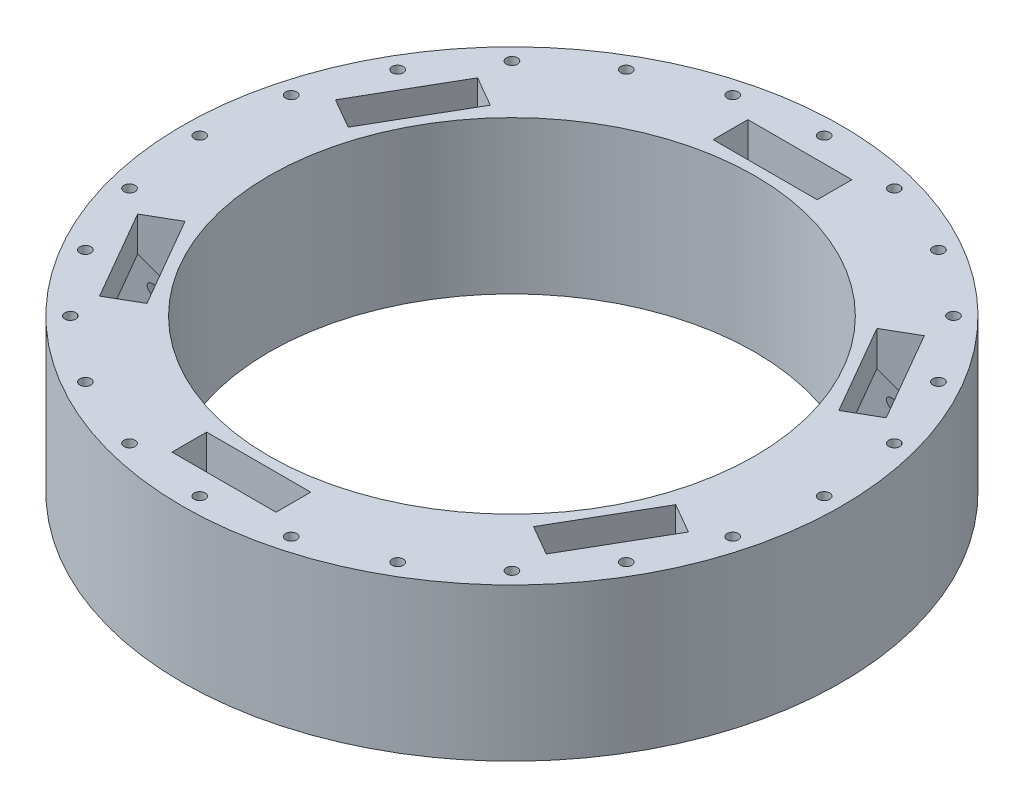
from build123d import *

# Parameters (mm, degrees)
SKETCH1_R            = 95
SKETCH1_R_2          = 70
BOSS_EXTRUDE1_DEPTH  = 44
CUT_EXTRUDE3_DEPTH   = 15
CIRPATTERN2_COUNT    = 6
M3_CLEARANCE_HOLE1_D = 3.2
M3_CLEARANCE_HOLE2_D = 3.2


with BuildPart() as part:
    # Sketch1 → Boss-Extrude1 (new body)
    with BuildSketch(Plane(origin=(0, 0, 0), x_dir=(1, 0, 0), z_dir=(0, 1, 0))):
        Circle(SKETCH1_R)
        Circle(SKETCH1_R_2, mode=Mode.SUBTRACT)
    extrude(amount=BOSS_EXTRUDE1_DEPTH)

    # Sketch7 → Cut-Extrude3 (cut, symmetric)
    with BuildSketch(Plane(origin=(0, 0, 0), x_dir=(0, -1, 0), z_dir=(-0.500000000000001, 0, 0.866025403784438))):
        Polygon((-44, 83), (-34, 83), (-29, 78), (-34, 73), (-44, 73), align=None)
        Polygon((-10, 83), (0, 83), (0, 73), (-10, 73), (-15, 78), align=None)
    cut_extrude3 = extrude(amount=CUT_EXTRUDE3_DEPTH, both=True, mode=Mode.SUBTRACT)

    # CirPattern2: Cut-Extrude3 ×6 about axis
    cirpattern2_axis = Axis((0, 44, 0), (0, -1, 0))
    for i in range(1, CIRPATTERN2_COUNT):
        add(cut_extrude3.rotate(cirpattern2_axis, i * 360 / CIRPATTERN2_COUNT), mode=Mode.SUBTRACT)

    # M3 Clearance Hole1 (through all)
    with Locations(Plane(origin=(0, 44, 0), x_dir=(1, 0, 0), z_dir=(0, 1, 0))):
        with Locations((62.549981495, -47.660254038), (72.549981495, -30.339745962), (-10, -78), (10, -78), (-72.549981495, -30.339745962), (-62.549981495, -47.660254038), (-62.549981495, 47.660254038), (-72.549981495, 30.339745962), (10, 78), (-10, 78), (72.549981495, 30.339745962), (62.549981495, 47.660254038), (0, 0)):
            Hole(M3_CLEARANCE_HOLE1_D / 2)

    # M3 Clearance Hole2 (through all)
    with Locations(Plane(origin=(0, 44, 0), x_dir=(1, 0, 0), z_dir=(0, 1, 0))):
        with Locations((0, 90), (23.293714059, 86.933324366), (45, 77.942286341), (63.639610307, 63.639610307), (77.942286341, 45), (86.933324366, 23.293714059), (90, 0), (86.933324366, -23.293714059), (77.942286341, -45), (63.639610307, -63.639610307), (45, -77.942286341), (23.293714059, -86.933324366), (0, -90), (-23.293714059, -86.933324366), (-45, -77.942286341), (-63.639610307, -63.639610307), (-77.942286341, -45), (-86.933324366, -23.293714059), (-90, 0), (-86.933324366, 23.293714059), (-77.942286341, 45), (-63.639610307, 63.639610307), (-45, 77.942286341), (-23.293714059, 86.933324366), (0, 0)):
            Hole(M3_CLEARANCE_HOLE2_D / 2)


solid = part.part
